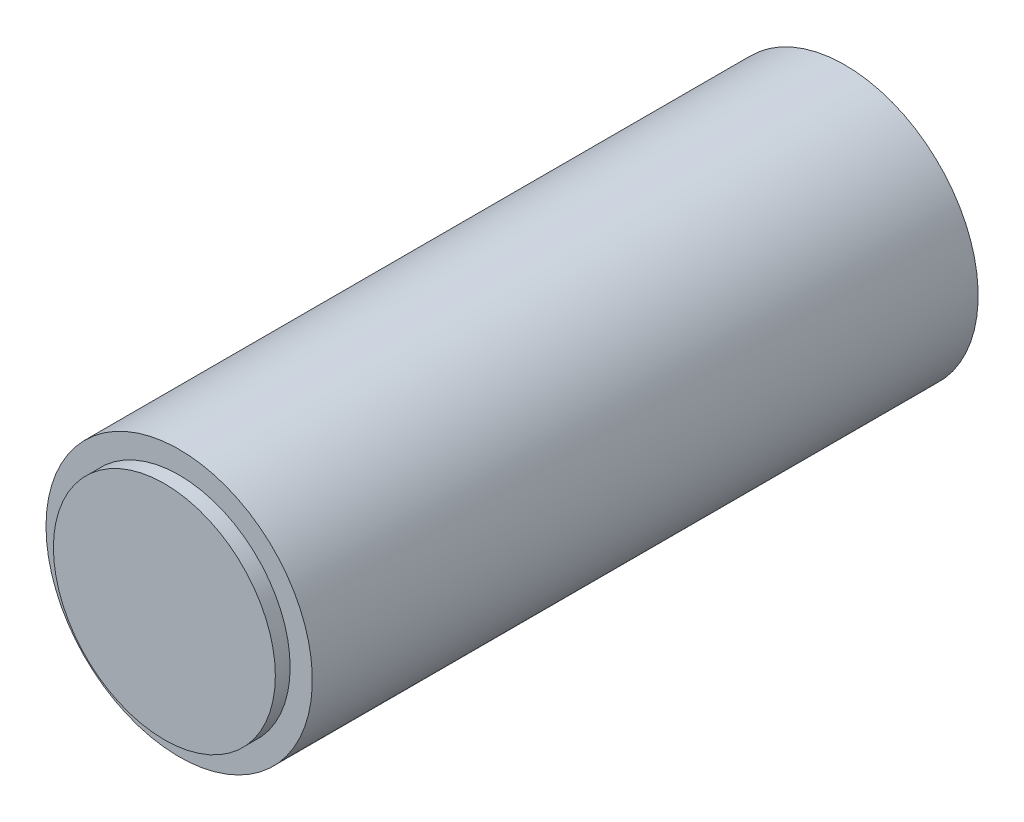
from build123d import *

# Parameters (mm, degrees)
SKETCH1_R           = 9
BOSS_EXTRUDE1_DEPTH = 45
SKETCH2_R           = 7.5
BOSS_EXTRUDE2_DEPTH = 1


with BuildPart() as part:
    # Sketch1 → Boss-Extrude1 (new body)
    with BuildSketch(Plane.XY):
        with Locations(Location((0, 0, 0), (0, 0, 180))):
            Circle(SKETCH1_R)
    extrude(amount=BOSS_EXTRUDE1_DEPTH)

    # Sketch2 → Boss-Extrude2 (add)
    with BuildSketch(Plane.XY.offset(45)):
        Circle(SKETCH2_R)
    extrude(amount=BOSS_EXTRUDE2_DEPTH)


solid = part.part
